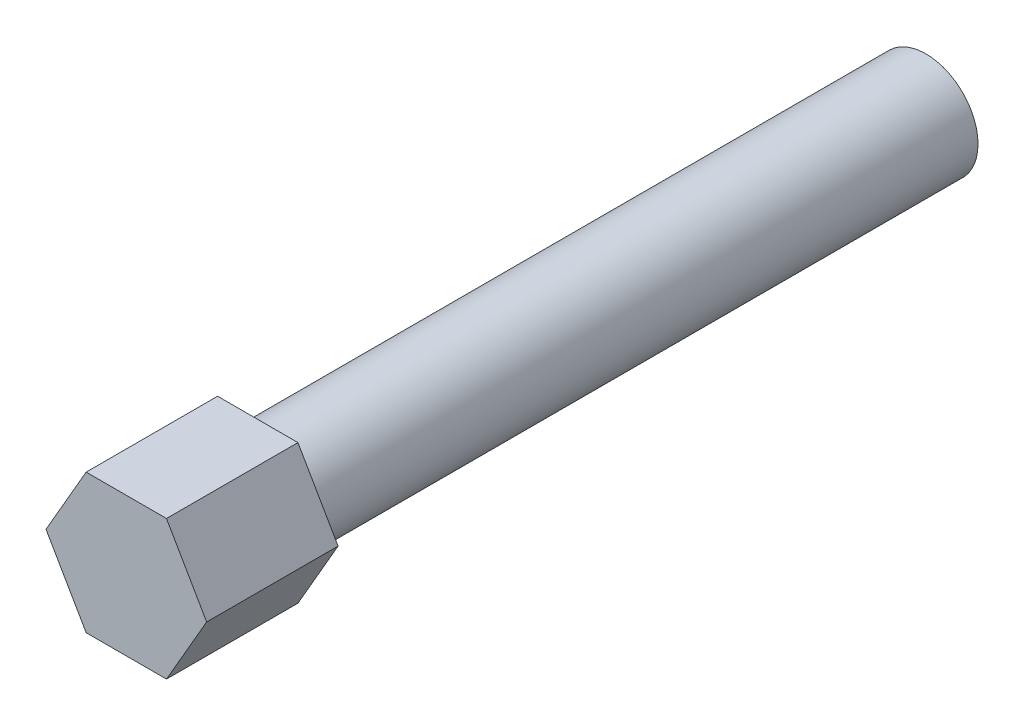
from build123d import *

# Parameters (mm, degrees)
BOSS_EXTRUDE1_DEPTH = 12
SKETCH2_R           = 4.75
BOSS_EXTRUDE2_DEPTH = 61
CUT_EXTRUDE1_DEPTH  = 14


with BuildPart() as part:
    # Sketch1 → Boss-Extrude1 (new body)
    with BuildSketch(Plane.XY):
        Polygon((3.666174209, -6.35), (7.332348419, 0), (3.666174209, 6.35), (-3.666174209, 6.35), (-7.332348419, 0), (-3.666174209, -6.35), align=None)
    extrude(amount=BOSS_EXTRUDE1_DEPTH)

    # Sketch2 → Boss-Extrude2 (add)
    with BuildSketch(Plane(origin=(0, 0, 0), x_dir=(-1, 0, 0), z_dir=(0, 0, -1))):
        with Locations(Location((0, 0, 0), (0, 0, 180))):
            Circle(SKETCH2_R)
    extrude(amount=BOSS_EXTRUDE2_DEPTH)

    # Sketch3 → Cut-Extrude1 (cut)
    with BuildSketch(Plane(origin=(0, 0, -61), x_dir=(-1, 0, 0), z_dir=(0, 0, -1))):
        with BuildLine():
            Line((-2.645751311, 3), (2.645751311, 3))
            ThreePointArc((2.645751311, 3), (4, 0), (2.645751311, -3))
            Line((2.645751311, -3), (-2.645751311, -3))
            ThreePointArc((-2.645751311, -3), (-4, 0), (-2.645751311, 3))
        make_face()
    extrude(amount=-CUT_EXTRUDE1_DEPTH, mode=Mode.SUBTRACT)


solid = part.part
